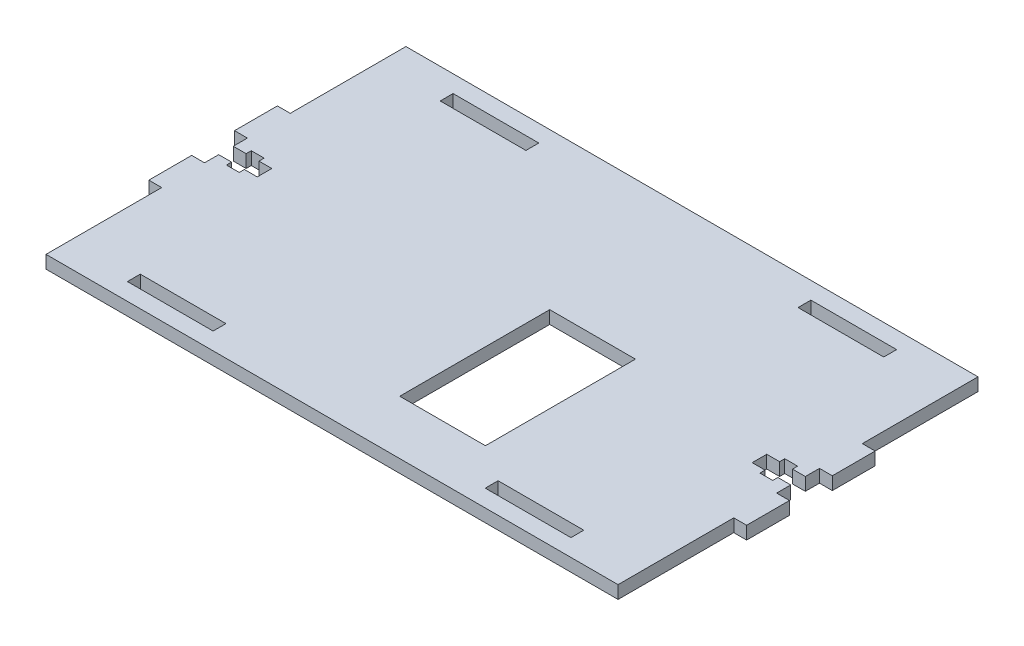
from build123d import *

# Parameters (mm, degrees)
SKETCH1_W           = 133.500000388
SKETCH1_H           = 84
BOSS_EXTRUDE1_DEPTH = 3
SKETCH2_W           = 20
SKETCH2_H           = 3
CUT_EXTRUDE1_DEPTH  = 104.014399147
SKETCH3_W           = 3
SKETCH3_H           = 30
BOSS_EXTRUDE2_DEPTH = 3
SKETCH4_W           = 3
SKETCH4_H           = 3.4
CUT_EXTRUDE2_DEPTH  = 106.612611798
SKETCH6_W           = 20
SKETCH6_H           = 35.000000221
CUT_EXTRUDE3_DEPTH  = 106.612611798


with BuildPart() as part:
    # Sketch1 → Boss-Extrude1 (new body)
    with BuildSketch(Plane(origin=(0, 0, 0), x_dir=(1, 0, 0), z_dir=(0, 1, 0))):
        with Locations((22.092889694, -10.056770433)):
            Rectangle(SKETCH1_W, SKETCH1_H)
    extrude(amount=BOSS_EXTRUDE1_DEPTH)

    # Sketch2 → Cut-Extrude1 (cut, through all)
    with BuildSketch(Plane.XZ):
        with Locations((63.842889888, 46.556770433)):
            Rectangle(SKETCH2_W, SKETCH2_H)
        with Locations((-19.6571105, 46.556770433)):
            Rectangle(SKETCH2_W, SKETCH2_H)
        with Locations((-19.6571105, -26.443229567)):
            Rectangle(SKETCH2_W, SKETCH2_H)
        with Locations((63.842889888, -26.443229567)):
            Rectangle(SKETCH2_W, SKETCH2_H)
    extrude(amount=-CUT_EXTRUDE1_DEPTH, mode=Mode.SUBTRACT)

    # Sketch3 → Boss-Extrude2 (add, through all)
    with BuildSketch(Plane.XZ):
        with Locations((90.342889888, 10.056770433)):
            Rectangle(SKETCH3_W, SKETCH3_H)
        with Locations((-46.1571105, 10.056770433)):
            Rectangle(SKETCH3_W, SKETCH3_H)
    extrude(amount=-BOSS_EXTRUDE2_DEPTH)

    # Sketch4 → Cut-Extrude2 (cut, symmetric)
    with BuildSketch(Plane.XZ):
        Polygon((88.842889888, 8.356770433), (88.842889888, 5.056770433), (91.842889888, 5.056770433), (91.842889888, 15.056770433), (88.842889888, 15.056770433), (88.842889888, 11.756770433), align=None)
        with Locations((87.342889888, 10.056770433)):
            Rectangle(SKETCH4_W, SKETCH4_H)
        Polygon((85.842889888, 7.156770433), (85.842889888, 8.356770433), (85.842889888, 11.756770433), (85.842889888, 12.956770433), (82.842889888, 12.956770433), (82.842889888, 11.756770433), (82.842889888, 8.356770433), (82.842889888, 7.156770433), align=None)
        with Locations((81.342889888, 10.056770433)):
            Rectangle(SKETCH4_W, SKETCH4_H)
    cut_extrude2 = extrude(amount=CUT_EXTRUDE2_DEPTH, both=True, mode=Mode.SUBTRACT)

    # Mirror1: Cut-Extrude2 across plane
    add(cut_extrude2.mirror(Plane(origin=(22.092889694, 0, 0), x_dir=(0, 0, 1), z_dir=(1, 0, 0))), mode=Mode.SUBTRACT)

    # Sketch6 → Cut-Extrude3 (cut, through all)
    with BuildSketch(Plane.XZ):
        with Locations((35.292890439, 21.956770364)):
            Rectangle(SKETCH6_W, SKETCH6_H)
    extrude(amount=-CUT_EXTRUDE3_DEPTH, mode=Mode.SUBTRACT)


solid = part.part
